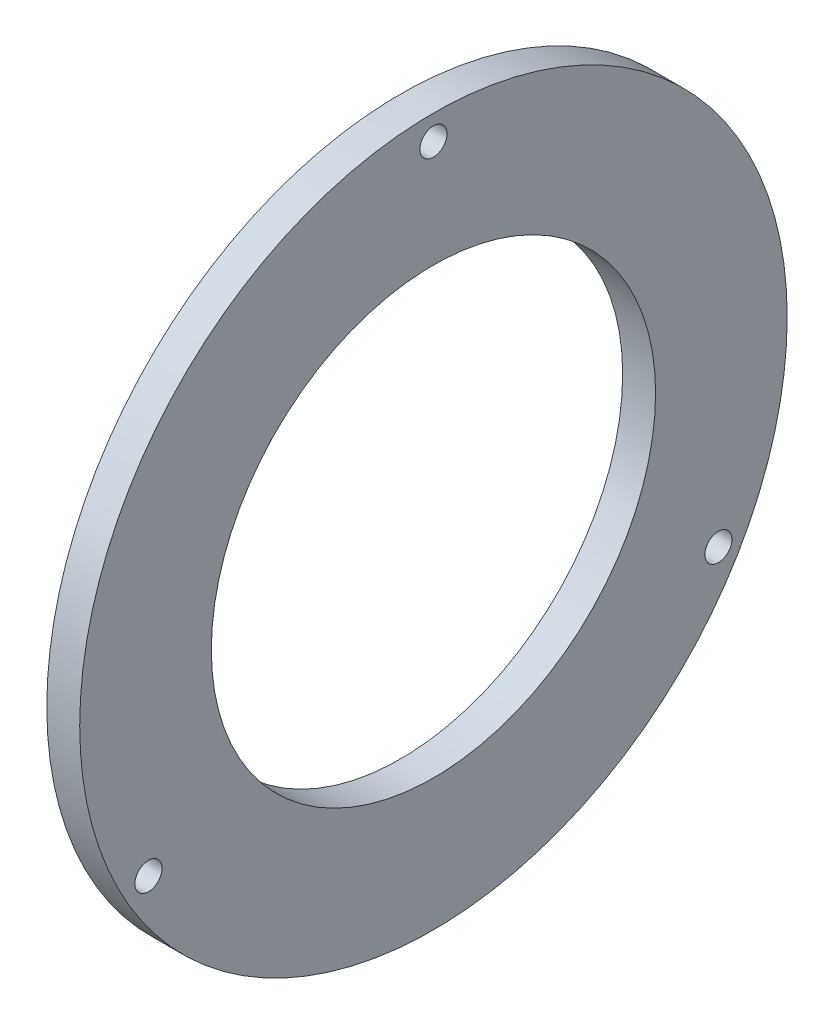
from build123d import *

# Parameters (mm, degrees)
AXIAL_PROFILE_MM_W     = 4
AXIAL_PROFILE_MM_H     = 16
AXIAL_HOLES_DEPTH      = 149.702689955
AXIAL_HOLES_DEPTH_BACK = 149.702689955
SKETCH2_R              = 1.65


with BuildPart() as part:
    # Axial profile (mm) → Full revolution (revolve)
    with BuildSketch(Plane.XY, mode=Mode.PRIVATE) as full_revolution_sk:
        with Locations((133.7, 35)):
            Rectangle(AXIAL_PROFILE_MM_W, AXIAL_PROFILE_MM_H)
    revolve(full_revolution_sk.sketch.rotate(Axis((-110, 0, 0), (1, 0, 0)), 90), axis=Axis((-110, 0, 0), (1, 0, 0)))

    # Sketch2 → Axial holes (cut, two sides: drawn at the far end of the back side and taken through both)
    with BuildSketch(Plane(origin=(0, 0, 0), x_dir=(0, 0, -1), z_dir=(1, 0, 0)).offset(-AXIAL_HOLES_DEPTH_BACK)):
        with Locations((0, 40)):
            Circle(SKETCH2_R)
        with Locations((-34.641016151, -20)):
            Circle(SKETCH2_R)
        with Locations((34.641016151, -20)):
            Circle(SKETCH2_R)
    extrude(amount=AXIAL_HOLES_DEPTH + AXIAL_HOLES_DEPTH_BACK, mode=Mode.SUBTRACT)


solid = part.part
